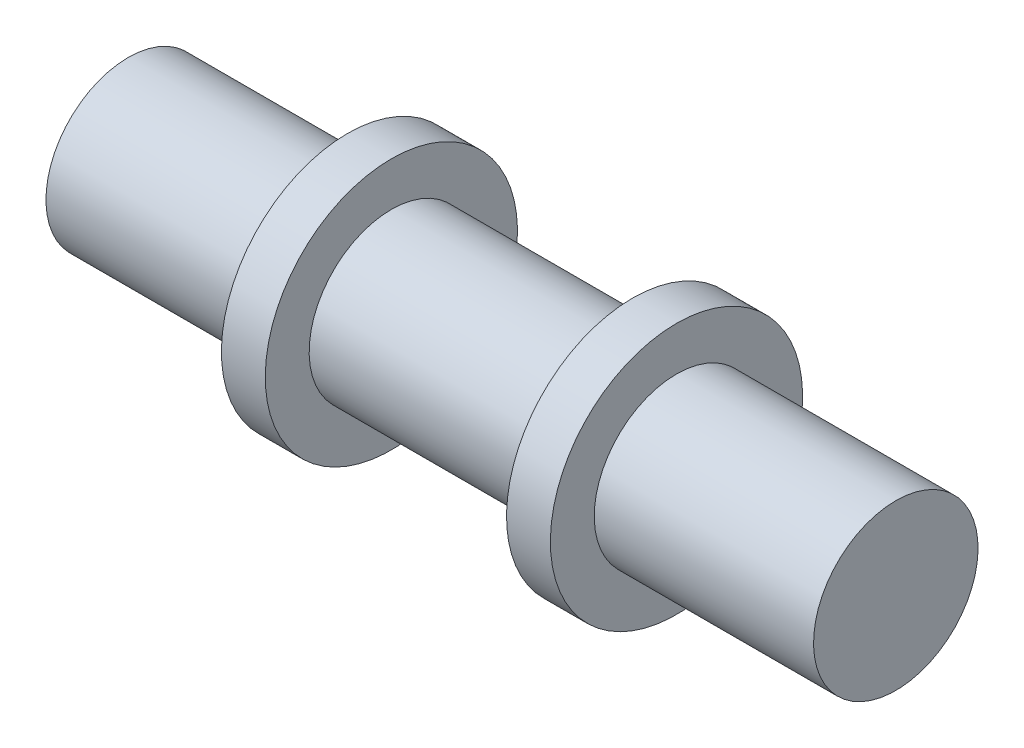
from build123d import *


with BuildPart() as part:
    # Sketch2 → Revolve1 (revolve)
    with BuildSketch(Plane.XY):
        Polygon((88.9, 0), (-88.9, 0), (-88.9, 19.05), (-38.1, 19.05), (-38.1, 29.21), (-27.94, 29.21), (-27.94, 19.05), (27.94, 19.05), (27.94, 29.21), (38.1, 29.21), (38.1, 19.05), (88.9, 19.05), align=None)
    revolve(axis=Axis((88.9, 0, 0), (-1, 0, 0)))


solid = part.part
